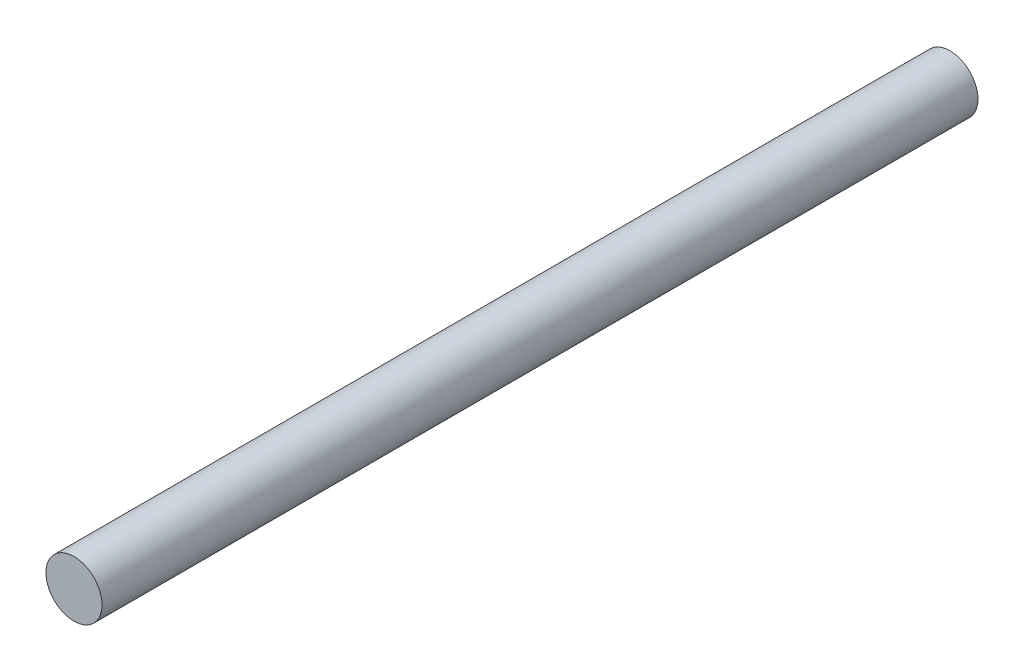
from build123d import *

# Parameters (mm, degrees)
SZKIC1_R                    = 16
DODANIE_WYCI_GNI_CIE1_DEPTH = 500


with BuildPart() as part:
    # Szkic1 → Dodanie-wyciągnięcie1 (new body)
    with BuildSketch(Plane.XY):
        Circle(SZKIC1_R)
    extrude(amount=DODANIE_WYCI_GNI_CIE1_DEPTH)


solid = part.part
